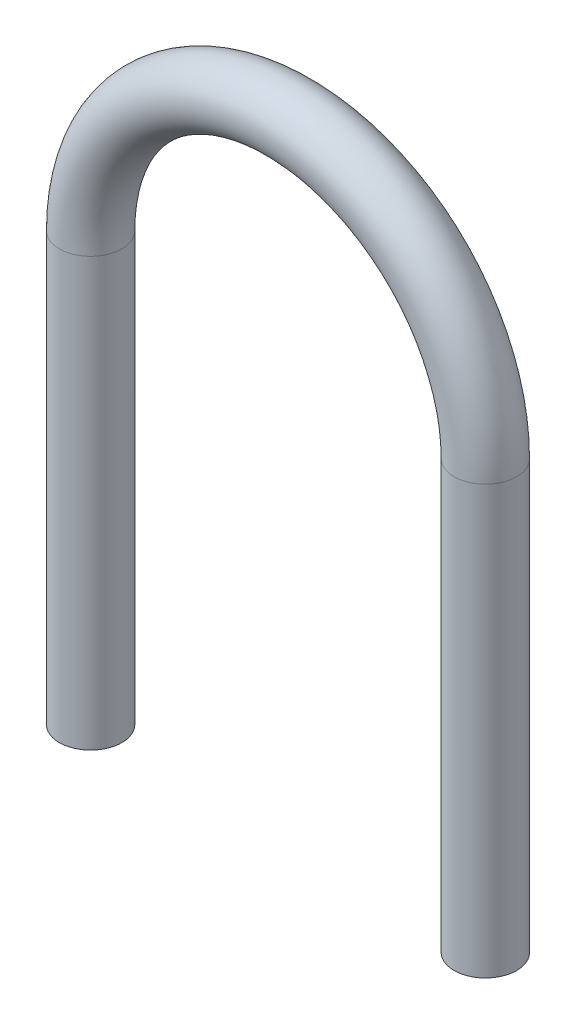
from build123d import *

# Parameters (mm, degrees)
SKETCH2_R = 1.425


with BuildPart() as part:
    # Sweep1: sweep along a path in Sketch1
    with BuildLine(Plane.XY) as sweep1_path:
        Line((0, -7.5), (0, 12))
        ThreePointArc((0, 12), (9, 21), (18, 12))
        Line((18, 12), (18, -7.5))
    # Sketch2 → Sweep1 (sweep)
    with BuildSketch(Plane(origin=(0, -7.5, 0), x_dir=(1, 0, 0), z_dir=(0, 1, 0))):
        Circle(SKETCH2_R)
    sweep(path=sweep1_path.line)


solid = part.part
